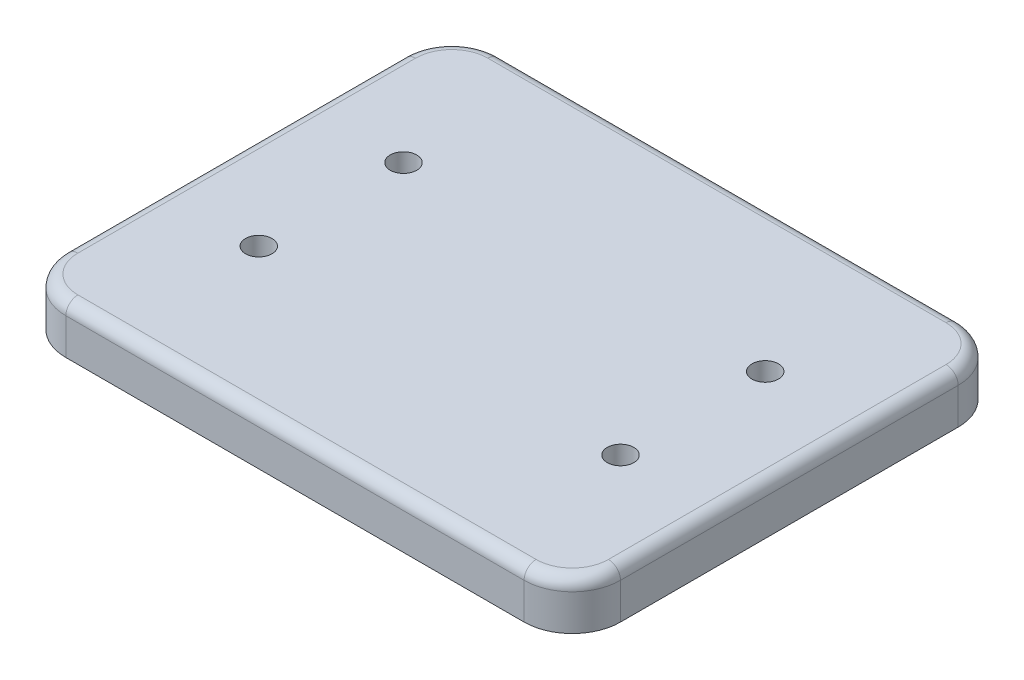
from build123d import *

# Parameters (mm, degrees)
SKETCH1_R           = 5.5
BOSS_EXTRUDE1_DEPTH = 20
SKETCH2_R           = 9
CUT_EXTRUDE1_DEPTH  = 11
FILLET1_R           = 5


with BuildPart() as part:
    # Sketch1 → Boss-Extrude1 (new body)
    with BuildSketch(Plane(origin=(0, 0, 0), x_dir=(1, 0, 0), z_dir=(0, 1, 0))):
        with BuildLine():
            Line((95, -90), (-95, -90))
            ThreePointArc((-95, -90), (-109.142135624, -84.142135624), (-115, -70))
            Line((-115, -70), (-115, 70))
            ThreePointArc((-115, 70), (-109.142135624, 84.142135624), (-95, 90))
            Line((-95, 90), (95, 90))
            ThreePointArc((95, 90), (109.142135624, 84.142135624), (115, 70))
            Line((115, 70), (115, -70))
            ThreePointArc((115, -70), (109.142135624, -84.142135624), (95, -90))
        make_face()
        with Locations(Location((-75, 30, 0), (0, 0, 270))):
            Circle(SKETCH1_R, mode=Mode.SUBTRACT)
        with Locations(Location((75, 30, 0), (0, 0, 270))):
            Circle(SKETCH1_R, mode=Mode.SUBTRACT)
        with Locations(Location((75, -30, 0), (0, 0, 270))):
            Circle(SKETCH1_R, mode=Mode.SUBTRACT)
        with Locations(Location((-75, -30, 0), (0, 0, 270))):
            Circle(SKETCH1_R, mode=Mode.SUBTRACT)
    extrude(amount=BOSS_EXTRUDE1_DEPTH)

    # Sketch2 → Cut-Extrude1 (cut)
    with BuildSketch(Plane.XZ):
        with Locations(Location((-75, 30, 0), (0, 0, 270))):
            Circle(SKETCH2_R)
        with Locations(Location((75, 30, 0), (0, 0, 270))):
            Circle(SKETCH2_R)
        with Locations(Location((75, -30, 0), (0, 0, 270))):
            Circle(SKETCH2_R)
        with Locations(Location((-75, -30, 0), (0, 0, 270))):
            Circle(SKETCH2_R)
    extrude(amount=-CUT_EXTRUDE1_DEPTH, mode=Mode.SUBTRACT)

    # Fillet1
    fillet1_edges = [part.edges().sort_by_distance(p)[0] for p in [
        (109.142135624, 20, -84.142135624),
        (0, 20, -90),
        (-109.142135624, 20, -84.142135624),
        (-115, 20, 0),
        (-109.142135624, 20, 84.142135624),
        (0, 20, 90),
        (109.142135624, 20, 84.142135624),
        (115, 20, 0),
    ]]
    fillet(fillet1_edges, radius=FILLET1_R)


solid = part.part
